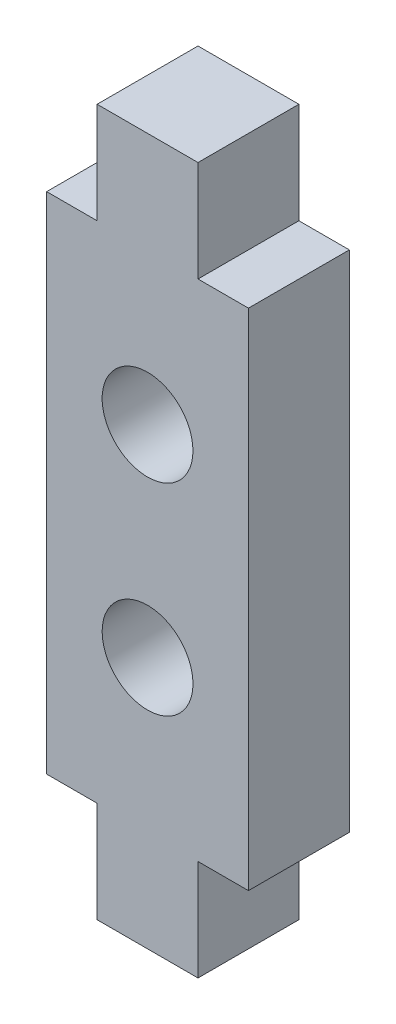
from build123d import *

# Parameters (mm, degrees)
SKETCH1_R           = 2.25
BOSS_EXTRUDE1_DEPTH = 5


with BuildPart() as part:
    # Sketch1 → Boss-Extrude1 (new body)
    with BuildSketch(Plane.XY):
        Polygon((2.5, -7.5), (5, -7.5), (5, 17.5), (2.5, 17.5), (2.5, 22.5), (-2.5, 22.5), (-2.5, 17.5), (-5, 17.5), (-5, -7.5), (-2.5, -7.5), (-2.5, -12.5), (2.5, -12.5), align=None)
        with Locations((0, 10)):
            Circle(SKETCH1_R, mode=Mode.SUBTRACT)
        with Locations(Location((0, 0, 0), (0, 0, 180))):
            Circle(SKETCH1_R, mode=Mode.SUBTRACT)
    extrude(amount=BOSS_EXTRUDE1_DEPTH)


solid = part.part
